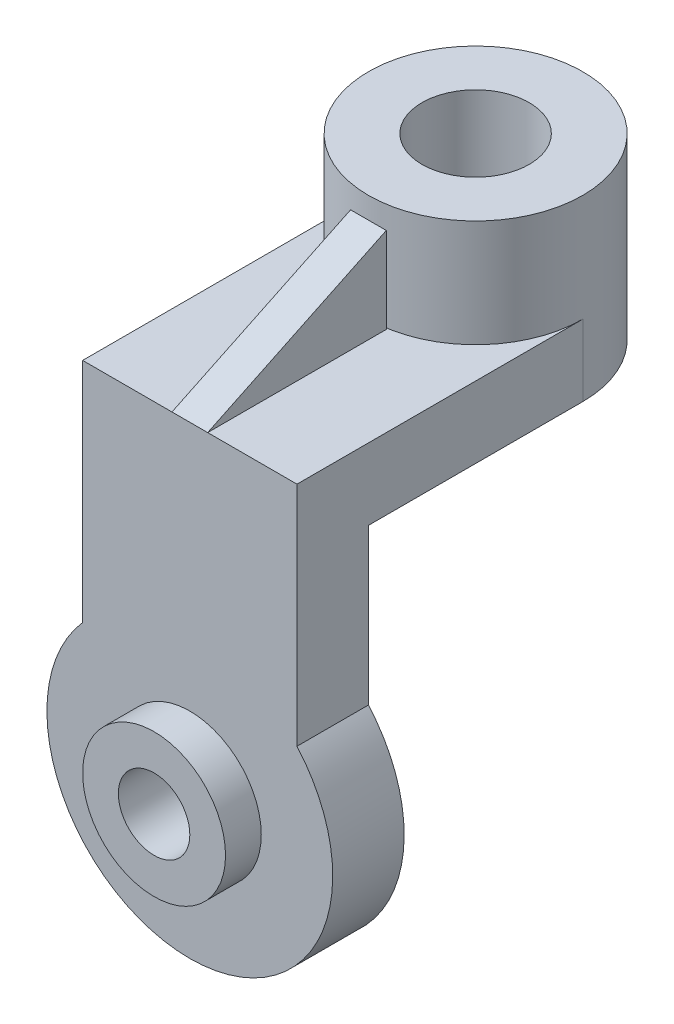
from build123d import *

# Parameters (mm, degrees)
SKETCH_1_R           = 10
EXTRUDE_1_DEPTH      = 10
EXTRUDE_2_DEPTH      = 15
EXTRUDE_2_DEPTH_BACK = 5
SKETCH_1_3_R         = 10
SKETCH_1_3_R_2       = 5
EXTRUDE_3_DEPTH      = 10
SKETCH_2_3_R         = 7.5
EXTRUDE_4_DEPTH      = 25
EXTRUDE_6_DEPTH      = 2.5


with BuildPart() as part:
    # 草图1 → 凸台-拉伸1 (new body)
    with BuildSketch(Plane.XY):
        with BuildLine():
            Line((0, 0), (0, -21.771243445))
            ThreePointArc((0, -21.771243445), (15, -55), (30, -21.771243445))
            Line((30, -21.771243445), (30, 0))
            Line((30, 0), (0, 0))
        make_face()
        with Locations((15, -35)):
            Circle(SKETCH_1_R, mode=Mode.SUBTRACT)
    extrude(amount=EXTRUDE_1_DEPTH)

    # 草图1<3> → 凸台-拉伸2 (add, two sides: drawn at the far end of the back side and taken through both)
    with BuildSketch(Plane.XY.offset(-EXTRUDE_2_DEPTH_BACK)):
        with Locations((15, -35)):
            Circle(SKETCH_1_3_R)
        with Locations((15, -35)):
            Circle(SKETCH_1_3_R_2, mode=Mode.SUBTRACT)
    extrude(amount=EXTRUDE_2_DEPTH + EXTRUDE_2_DEPTH_BACK)

    # 草图2 → 凸台-拉伸3 (add)
    with BuildSketch(Plane(origin=(0, 0, 0), x_dir=(1, 0, 0), z_dir=(0, 1, 0))):
        with BuildLine():
            Line((0, -10), (30, -10))
            Line((30, -10), (30, 30))
            ThreePointArc((30, 30), (15, 15), (0, 30))
            Line((0, 30), (0, -10))
        make_face()
    extrude(amount=EXTRUDE_3_DEPTH)

    # 草图2<3> → 凸台-拉伸4 (add)
    with BuildSketch(Plane(origin=(0, 0, 0), x_dir=(1, 0, 0), z_dir=(0, 1, 0))):
        with BuildLine():
            ThreePointArc((0, 30), (15, 15), (30, 30))
            ThreePointArc((30, 30), (15, 45), (0, 30))
        make_face()
        with Locations((15, 30)):
            Circle(SKETCH_2_3_R, mode=Mode.SUBTRACT)
    extrude(amount=EXTRUDE_4_DEPTH)


with BuildPart() as body_2:
    # 草图3 → 凸台-拉伸6 (new, symmetric)
    with BuildSketch(Plane(origin=(15, 0, 0), x_dir=(0, 0, -1), z_dir=(1, 0, 0))):
        Polygon((15, 10), (15, 22), (-10, 10), align=None)
    extrude(amount=EXTRUDE_6_DEPTH, both=True)


solid = Compound([part.part, body_2.part])
